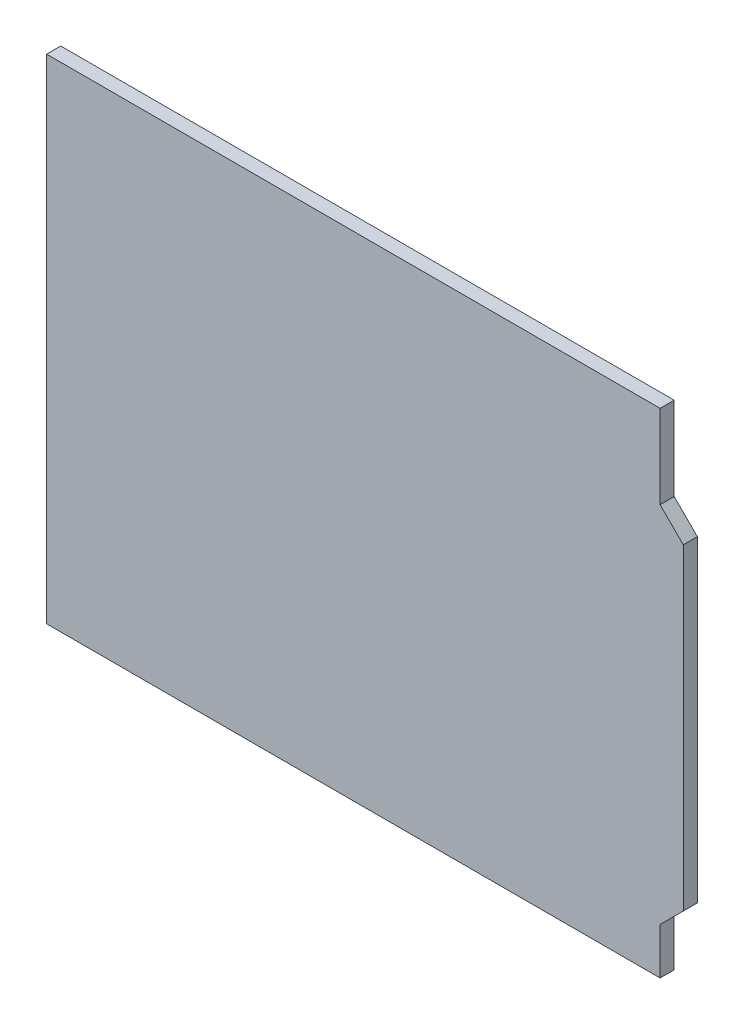
from build123d import *

# Parameters (mm, degrees)
SALIENTE_EXTRUIR1_DEPTH = 1.52


with BuildPart() as part:
    # Croquis1 → Saliente-Extruir1 (new body)
    with BuildSketch(Plane.XY):
        Polygon((-2.5, 53.21), (-2.5, 44.21), (0, 41.71), (0, 7.5), (-2.5, 5), (-2.5, 0), (-68.66, 0), (-68.66, 53.21), align=None)
    extrude(amount=SALIENTE_EXTRUIR1_DEPTH)


solid = part.part
